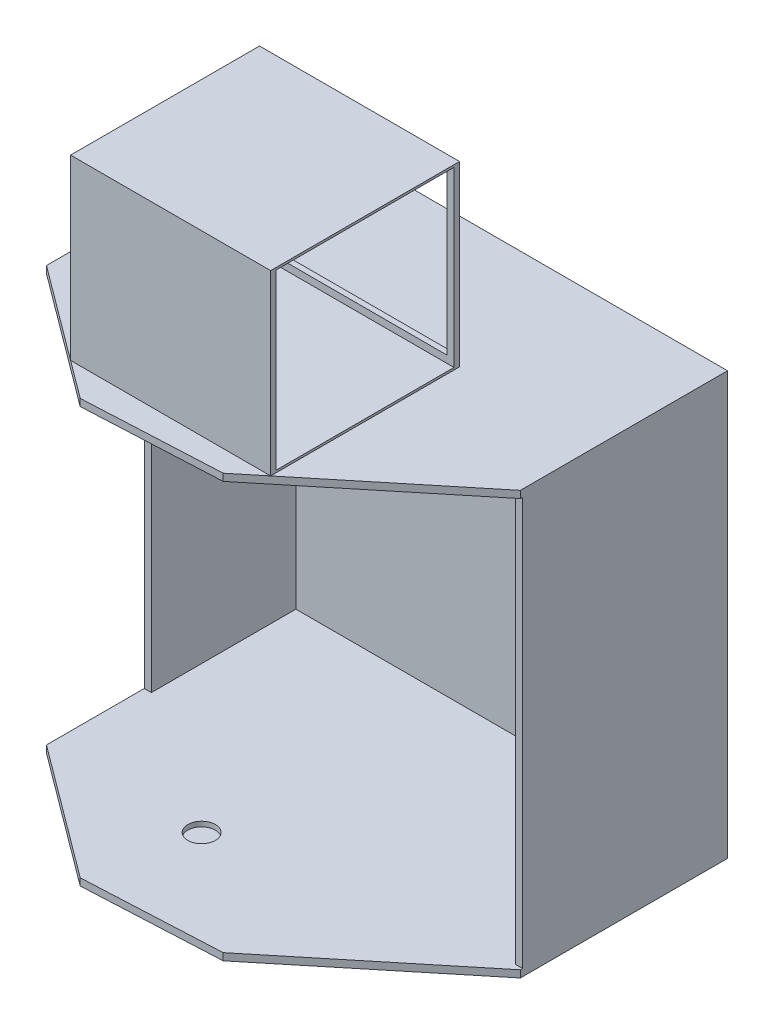
from build123d import *

# Parameters (mm, degrees)
BOSS_EXTRUDE1_DEPTH = 3.2
SKETCH3_R           = 12.3
BOSS_EXTRUDE2_DEPTH = 3.2
SKETCH4_R           = 4
BOSS_EXTRUDE3_DEPTH = 4
SKETCH6_W           = 3.2
SKETCH6_H           = 65
BOSS_EXTRUDE4_DEPTH = 190
SKETCH8_W           = 3.2
SKETCH8_H           = 89
BOSS_EXTRUDE5_DEPTH = 190
SKETCH9_W           = 194.2
SKETCH9_H           = 190
BOSS_EXTRUDE7_DEPTH = 3.2
SKETCH11_R          = 6.2
CUT_EXTRUDE2_DEPTH  = 94
SKETCH12_R          = 35
BOSS_EXTRUDE8_DEPTH = 20
SKETCH14_W          = 90
SKETCH14_H          = 85
BOSS_EXTRUDE9_DEPTH = 80
SKETCH15_W          = 80
SKETCH15_H          = 78
CUT_EXTRUDE3_DEPTH  = 88
SKETCH16_W          = 83.876304214
SKETCH16_H          = 71.530824042
CUT_EXTRUDE7_DEPTH  = 10


with BuildPart() as part:
    # Sketch1 → Boss-Extrude1 (new body)
    with BuildSketch(Plane(origin=(0, 0, 0), x_dir=(1, 0, 0), z_dir=(0, 1, 0))):
        Polygon((-71.199297972, 0), (119.800702028, 0), (119.800702028, -90), (46.272924854, -150.155348756), (-15.035731115, -153.181069815), (-74.399297972, -109), (-74.399297972, -65), (-71.199297972, -65), align=None)
    boss_extrude1 = extrude(amount=BOSS_EXTRUDE1_DEPTH)

    # Sketch3 → Boss-Extrude2 (add)
    with BuildSketch(Plane.XZ):
        with Locations(Location((-5.399297972, 108.199281837, 0), (0, 0, 270))):
            Circle(SKETCH3_R)
    boss_extrude2 = extrude(amount=BOSS_EXTRUDE2_DEPTH)

    # Sketch4 → Boss-Extrude3 (add)
    with BuildSketch(Plane.XZ.offset(3.2)):
        with Locations(Location((-5.399297972, 108.199281837, 0), (0, 0, 270))):
            Circle(SKETCH4_R)
    boss_extrude3 = extrude(amount=BOSS_EXTRUDE3_DEPTH)

    # Sketch6 → Boss-Extrude4 (add)
    with BuildSketch(Plane(origin=(0, 0, 0), x_dir=(1, 0, 0), z_dir=(0, 1, 0))):
        with Locations((-72.799297972, -32.5)):
            Rectangle(SKETCH6_W, SKETCH6_H)
    extrude(amount=BOSS_EXTRUDE4_DEPTH)

    # Sketch8 → Boss-Extrude5 (add)
    with BuildSketch(Plane(origin=(0, 0, 0), x_dir=(1, 0, 0), z_dir=(0, 1, 0))):
        with Locations((118.200702028, -44.5)):
            Rectangle(SKETCH8_W, SKETCH8_H)
    extrude(amount=BOSS_EXTRUDE5_DEPTH)

    # Mirror1: Boss-Extrude1, Boss-Extrude2, Boss-Extrude3 across plane
    add(boss_extrude1.mirror(Plane(origin=(0, 95, 0), x_dir=(0, 0, 1), z_dir=(0, -1, 0))))
    add(boss_extrude2.mirror(Plane(origin=(0, 95, 0), x_dir=(0, 0, 1), z_dir=(0, -1, 0))))
    add(boss_extrude3.mirror(Plane(origin=(0, 95, 0), x_dir=(0, 0, 1), z_dir=(0, -1, 0))))

    # Sketch9 → Boss-Extrude7 (add)
    with BuildSketch(Plane.XY):
        with Locations((22.700702028, 95)):
            Rectangle(SKETCH9_W, SKETCH9_H)
    extrude(amount=-BOSS_EXTRUDE7_DEPTH)

    # Sketch11 → Cut-Extrude2 (cut, symmetric)
    with BuildSketch(Plane(origin=(0, 95, 0), x_dir=(1, 0, 0), z_dir=(0, 1, 0))):
        with Locations(Location((-5.399297972, -108.199281837, 0), (0, 0, 270))):
            Circle(SKETCH11_R)
    extrude(amount=CUT_EXTRUDE2_DEPTH, both=True, mode=Mode.SUBTRACT)

    # Sketch12 → Boss-Extrude8 (add)
    with BuildSketch(Plane(origin=(0, 0, -3.2), x_dir=(-1, 0, 0), z_dir=(0, 0, -1))):
        with Locations((-22.700702028, 95)):
            Circle(SKETCH12_R)
    extrude(amount=BOSS_EXTRUDE8_DEPTH)

    # Sketch14 → Boss-Extrude9 (add)
    with BuildSketch(Plane(origin=(0, 190, 0), x_dir=(1, 0, 0), z_dir=(0, 1, 0))):
        with Locations((13.00356987, -98.058145234)):
            Rectangle(SKETCH14_W, SKETCH14_H)
    extrude(amount=BOSS_EXTRUDE9_DEPTH)

    # Sketch15 → Cut-Extrude3 (cut)
    with BuildSketch(Plane(origin=(58.00356987, 0, 0), x_dir=(0, 0, -1), z_dir=(1, 0, 0))):
        with Locations((-98.058145234, 230)):
            Rectangle(SKETCH15_W, SKETCH15_H)
    extrude(amount=-CUT_EXTRUDE3_DEPTH, mode=Mode.SUBTRACT)

    # Sketch16 → Cut-Extrude7 (cut)
    with BuildSketch(Plane.XY.offset(58.058145234)):
        with Locations((13.00356987, 230)):
            Rectangle(SKETCH16_W, SKETCH16_H)
    extrude(amount=-CUT_EXTRUDE7_DEPTH, mode=Mode.SUBTRACT)


solid = part.part
